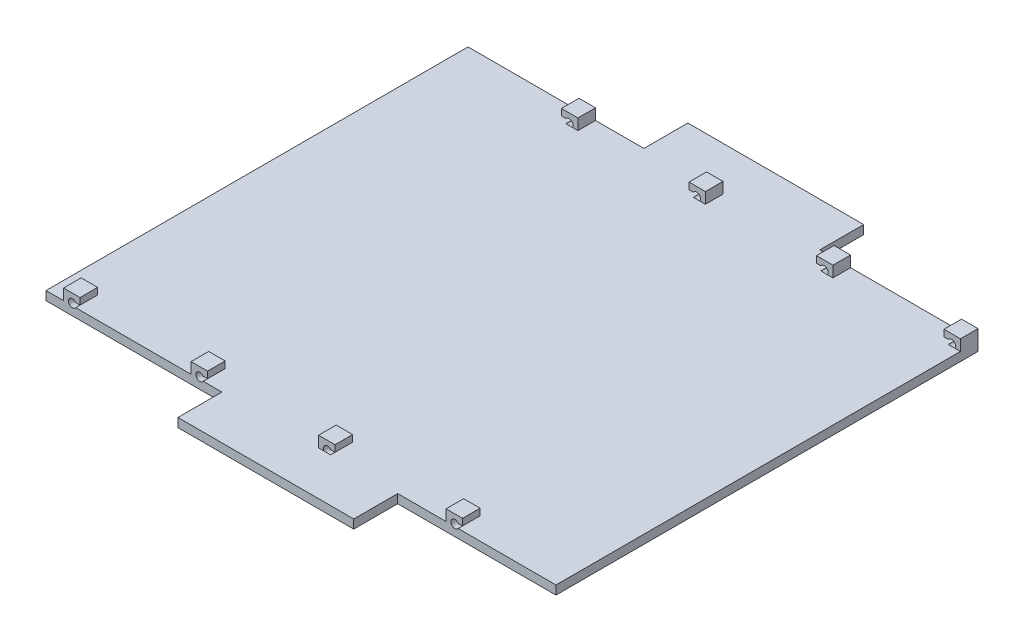
from build123d import *

# Parameters (mm, degrees)
BOSS_EXTRUDE1_DEPTH    = 2
BOSS_EXTRUDE2_DEPTH    = 4
CUT_EXTRUDE1_DEPTH     = 4
CIRPATTERN1_COUNT      = 2
LPATTERN4_COUNT        = 4
LPATTERN4_PITCH        = 29
LPATTERN4_COPY_1_DEPTH = 4
LPATTERN4_COPY_2_DEPTH = 4
LPATTERN4_COPY_3_DEPTH = 4
LPATTERN4_COPY_4_DEPTH = 4
LPATTERN4_COPY_5_DEPTH = 4
LPATTERN4_COPY_6_DEPTH = 4


with BuildPart() as part:
    # Sketch1 → Boss-Extrude1 (new body)
    with BuildSketch(Plane(origin=(0, 0, 0), x_dir=(1, 0, 0), z_dir=(0, 1, 0))):
        Polygon((-18, -58), (-18, -48), (-58, -48), (-58, 48), (-18, 48), (-18, 58), (22, 58), (22, 48), (58, 48), (58, -48), (22, -48), (22, -58), align=None)
    extrude(amount=BOSS_EXTRUDE1_DEPTH)

    # Sketch2 → Boss-Extrude2 (add)
    with BuildSketch(Plane(origin=(0, 0, -48), x_dir=(-1, 0, 0), z_dir=(0, 0, -1))):
        with BuildLine():
            ThreePointArc((-55.251668523, 2), (-56.9, 2.5), (-55.251668523, 3))
            Line((-55.251668523, 3), (-54.251668523, 3))
            Line((-54.251668523, 3), (-54.251668523, 4.5))
            Line((-54.251668523, 4.5), (-58, 4.5))
            Line((-58, 4.5), (-58, 0))
            Line((-58, 0), (-54.251668523, 0))
            Line((-54.251668523, 0), (-54.251668523, 2))
            Line((-54.251668523, 2), (-55.251668523, 2))
        make_face()
    boss_extrude2 = extrude(amount=-BOSS_EXTRUDE2_DEPTH)

    # Sketch2<3> → Cut-Extrude1 (cut)
    with BuildSketch(Plane(origin=(0, 0, -48), x_dir=(-1, 0, 0), z_dir=(0, 0, -1))):
        with BuildLine():
            Line((-55.251668523, 2), (-56.748331477, 2))
            ThreePointArc((-56.748331477, 2), (-56, 1.6), (-55.251668523, 2))
        make_face()
    cut_extrude1 = extrude(amount=-CUT_EXTRUDE1_DEPTH, mode=Mode.SUBTRACT)

    # CirPattern1: Boss-Extrude2, Cut-Extrude1 ×2 about axis
    cirpattern1_axis = Axis((45.5, 2, 0), (0, 1, 0))
    add([boss_extrude2.rotate(cirpattern1_axis, i * 360 / CIRPATTERN1_COUNT) for i in range(1, CIRPATTERN1_COUNT)])
    add([cut_extrude1.rotate(cirpattern1_axis, i * 360 / CIRPATTERN1_COUNT) for i in range(1, CIRPATTERN1_COUNT)], mode=Mode.SUBTRACT)

    # LPattern4: Boss-Extrude2, Cut-Extrude1 ×4
    with Locations(*[(-i * LPATTERN4_PITCH, 0, 0) for i in range(1, LPATTERN4_COUNT)]):
        add(boss_extrude2)
        add(cut_extrude1, mode=Mode.SUBTRACT)

    # LPattern4 copy 1 sketch → LPattern4 copy 1 (add)
    with BuildSketch(Plane(origin=(62, 0, 48), x_dir=(1, 0, 0), z_dir=(0, 0, 1))):
        with BuildLine():
            ThreePointArc((-55.251668523, 2), (-56.9, 2.5), (-55.251668523, 3))
            Line((-55.251668523, 3), (-54.251668523, 3))
            Line((-54.251668523, 3), (-54.251668523, 4.5))
            Line((-54.251668523, 4.5), (-58, 4.5))
            Line((-58, 4.5), (-58, 0))
            Line((-58, 0), (-54.251668523, 0))
            Line((-54.251668523, 0), (-54.251668523, 2))
            Line((-54.251668523, 2), (-55.251668523, 2))
        make_face()
    extrude(amount=-LPATTERN4_COPY_1_DEPTH)

    # LPattern4 copy 2 sketch → LPattern4 copy 2 (add)
    with BuildSketch(Plane(origin=(33, 0, 48), x_dir=(1, 0, 0), z_dir=(0, 0, 1))):
        with BuildLine():
            ThreePointArc((-55.251668523, 2), (-56.9, 2.5), (-55.251668523, 3))
            Line((-55.251668523, 3), (-54.251668523, 3))
            Line((-54.251668523, 3), (-54.251668523, 4.5))
            Line((-54.251668523, 4.5), (-58, 4.5))
            Line((-58, 4.5), (-58, 0))
            Line((-58, 0), (-54.251668523, 0))
            Line((-54.251668523, 0), (-54.251668523, 2))
            Line((-54.251668523, 2), (-55.251668523, 2))
        make_face()
    extrude(amount=-LPATTERN4_COPY_2_DEPTH)

    # LPattern4 copy 3 sketch → LPattern4 copy 3 (add)
    with BuildSketch(Plane(origin=(4, 0, 48), x_dir=(1, 0, 0), z_dir=(0, 0, 1))):
        with BuildLine():
            ThreePointArc((-55.251668523, 2), (-56.9, 2.5), (-55.251668523, 3))
            Line((-55.251668523, 3), (-54.251668523, 3))
            Line((-54.251668523, 3), (-54.251668523, 4.5))
            Line((-54.251668523, 4.5), (-58, 4.5))
            Line((-58, 4.5), (-58, 0))
            Line((-58, 0), (-54.251668523, 0))
            Line((-54.251668523, 0), (-54.251668523, 2))
            Line((-54.251668523, 2), (-55.251668523, 2))
        make_face()
    extrude(amount=-LPATTERN4_COPY_3_DEPTH)

    # LPattern4 copy 4 sketch → LPattern4 copy 4 (cut)
    with BuildSketch(Plane(origin=(62, 0, 48), x_dir=(1, 0, 0), z_dir=(0, 0, 1))):
        with BuildLine():
            Line((-55.251668523, 2), (-56.748331477, 2))
            ThreePointArc((-56.748331477, 2), (-56, 1.6), (-55.251668523, 2))
        make_face()
    extrude(amount=-LPATTERN4_COPY_4_DEPTH, mode=Mode.SUBTRACT)

    # LPattern4 copy 5 sketch → LPattern4 copy 5 (cut)
    with BuildSketch(Plane(origin=(33, 0, 48), x_dir=(1, 0, 0), z_dir=(0, 0, 1))):
        with BuildLine():
            Line((-55.251668523, 2), (-56.748331477, 2))
            ThreePointArc((-56.748331477, 2), (-56, 1.6), (-55.251668523, 2))
        make_face()
    extrude(amount=-LPATTERN4_COPY_5_DEPTH, mode=Mode.SUBTRACT)

    # LPattern4 copy 6 sketch → LPattern4 copy 6 (cut)
    with BuildSketch(Plane(origin=(4, 0, 48), x_dir=(1, 0, 0), z_dir=(0, 0, 1))):
        with BuildLine():
            Line((-55.251668523, 2), (-56.748331477, 2))
            ThreePointArc((-56.748331477, 2), (-56, 1.6), (-55.251668523, 2))
        make_face()
    extrude(amount=-LPATTERN4_COPY_6_DEPTH, mode=Mode.SUBTRACT)


solid = part.part
